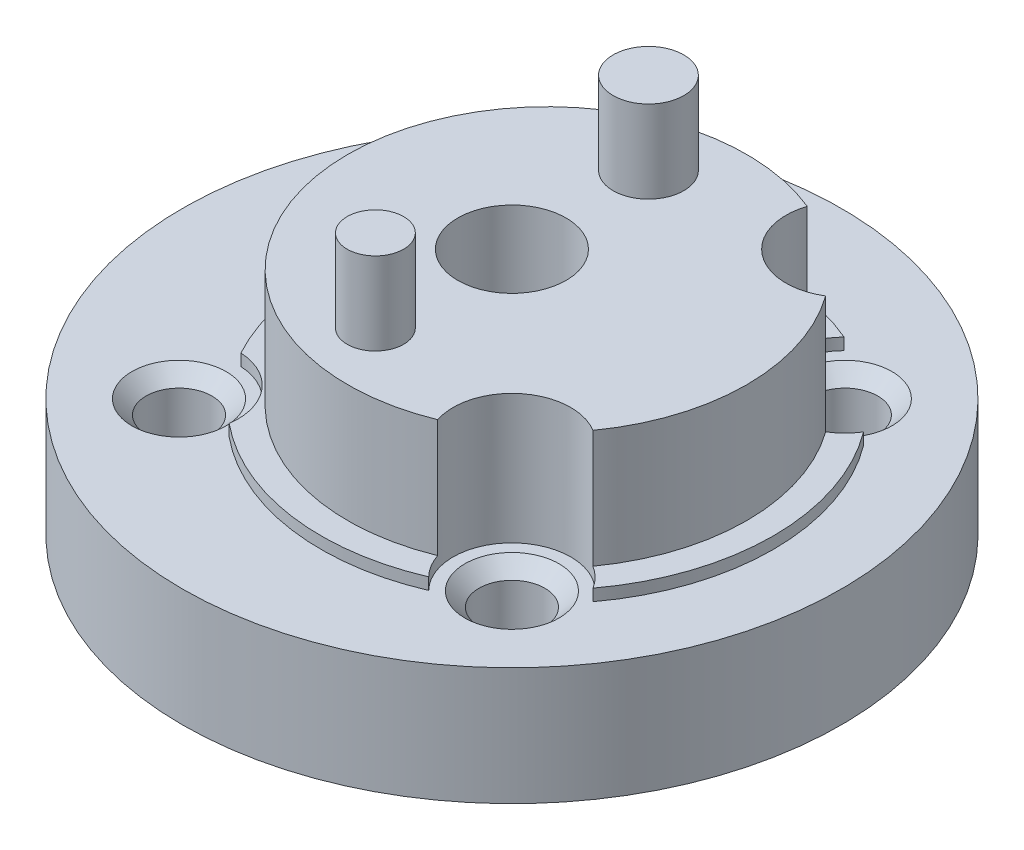
from build123d import *

# Parameters (mm, degrees)
SKETCH1_R           = 14
BOSS_EXTRUDE1_DEPTH = 5
SKETCH2_R           = 9.6
BOSS_EXTRUDE2_DEPTH = 0.5
SKETCH3_R           = 8.475
BOSS_EXTRUDE3_DEPTH = 5
SKETCH4_R           = 1.4
CUT_EXTRUDE1_DEPTH  = 21.548722588
CIRPATTERN1_COUNT   = 4
SKETCH5_R           = 2.5
CUT_EXTRUDE2_DEPTH  = 21.548722588
CHAMFER1_SIZE       = 0.6
SKETCH6_R           = 4.25
CUT_EXTRUDE3_DEPTH  = 2.5
SKETCH7_R           = 2.3
CUT_EXTRUDE4_DEPTH  = 6.5
SKETCH8_R           = 1.5
SKETCH8_R_2         = 1.2
BOSS_EXTRUDE4_DEPTH = 3.5


with BuildPart() as part:
    # Sketch1 → Boss-Extrude1 (new body)
    with BuildSketch(Plane(origin=(0, 0, 0), x_dir=(1, 0, 0), z_dir=(0, 1, 0))):
        with Locations(Location((0, 0, 0), (0, 0, 270))):
            Circle(SKETCH1_R)
    extrude(amount=BOSS_EXTRUDE1_DEPTH)

    # Sketch2 → Boss-Extrude2 (add)
    with BuildSketch(Plane(origin=(0, 5, 0), x_dir=(1, 0, 0), z_dir=(0, 1, 0))):
        with Locations(Location((1.5, 0, 0), (0, 0, 270))):
            Circle(SKETCH2_R)
    extrude(amount=BOSS_EXTRUDE2_DEPTH)

    # Sketch3 → Boss-Extrude3 (add)
    with BuildSketch(Plane(origin=(0, 5.5, 0), x_dir=(1, 0, 0), z_dir=(0, 1, 0))):
        with Locations(Location((1.5, 0, 0), (0, 0, 270))):
            Circle(SKETCH3_R)
    extrude(amount=BOSS_EXTRUDE3_DEPTH)

    # Sketch4 → Cut-Extrude1 (cut, through all)
    with BuildSketch(Plane(origin=(0, 5, 0), x_dir=(1, 0, 0), z_dir=(0, 1, 0))):
        with Locations(Location((-7.071067812, 7.071067812, 0), (0, 0, 270))):
            Circle(SKETCH4_R)
    cut_extrude1 = extrude(amount=-CUT_EXTRUDE1_DEPTH, mode=Mode.SUBTRACT)

    # CirPattern1: Cut-Extrude1 ×4 about axis
    cirpattern1_axis = Axis((0, 0, 0), (0, 1, 0))
    for i in range(1, CIRPATTERN1_COUNT):
        add(cut_extrude1.rotate(cirpattern1_axis, i * 360 / CIRPATTERN1_COUNT), mode=Mode.SUBTRACT)

    # Sketch5 → Cut-Extrude2 (cut, through all)
    with BuildSketch(Plane(origin=(0, 5, 0), x_dir=(1, 0, 0), z_dir=(0, 1, 0))):
        with Locations((-7.071067812, 7.071067812)):
            Circle(SKETCH5_R)
        with Locations((7.071067812, 7.071067812)):
            Circle(SKETCH5_R)
        with Locations((7.071067812, -7.071067812)):
            Circle(SKETCH5_R)
        with Locations((-7.071067812, -7.071067812)):
            Circle(SKETCH5_R)
    extrude(amount=CUT_EXTRUDE2_DEPTH, mode=Mode.SUBTRACT)

    # Chamfer1
    chamfer1_edges = [part.edges().sort_by_distance(p)[0] for p in [
        (-7.071067812, 5, -8.471067812),
        (8.471067812, 5, -7.071067812),
        (7.071067812, 5, 8.471067812),
        (-8.471067812, 5, 7.071067812),
    ]]
    chamfer(chamfer1_edges, length=CHAMFER1_SIZE)

    # Sketch6 → Cut-Extrude3 (cut)
    with BuildSketch(Plane.XZ):
        with Locations(Location((0, 0, 0), (0, 0, 270))):
            Circle(SKETCH6_R)
    extrude(amount=-CUT_EXTRUDE3_DEPTH, mode=Mode.SUBTRACT)

    # Sketch7 → Cut-Extrude4 (cut)
    with BuildSketch(Plane(origin=(0, 10.5, 0), x_dir=(1, 0, 0), z_dir=(0, 1, 0))):
        with Locations(Location((0, 0, 0), (0, 0, 270))):
            Circle(SKETCH7_R)
    extrude(amount=-CUT_EXTRUDE4_DEPTH, mode=Mode.SUBTRACT)

    # Sketch8 → Boss-Extrude4 (add)
    with BuildSketch(Plane(origin=(0, 10.5, 0), x_dir=(1, 0, 0), z_dir=(0, 1, 0))):
        with Locations(Location((0, 5.8, 0), (0, 0, 270))):
            Circle(SKETCH8_R)
        with Locations(Location((0, -5.8, 0), (0, 0, 270))):
            Circle(SKETCH8_R_2)
    extrude(amount=BOSS_EXTRUDE4_DEPTH)


solid = part.part
